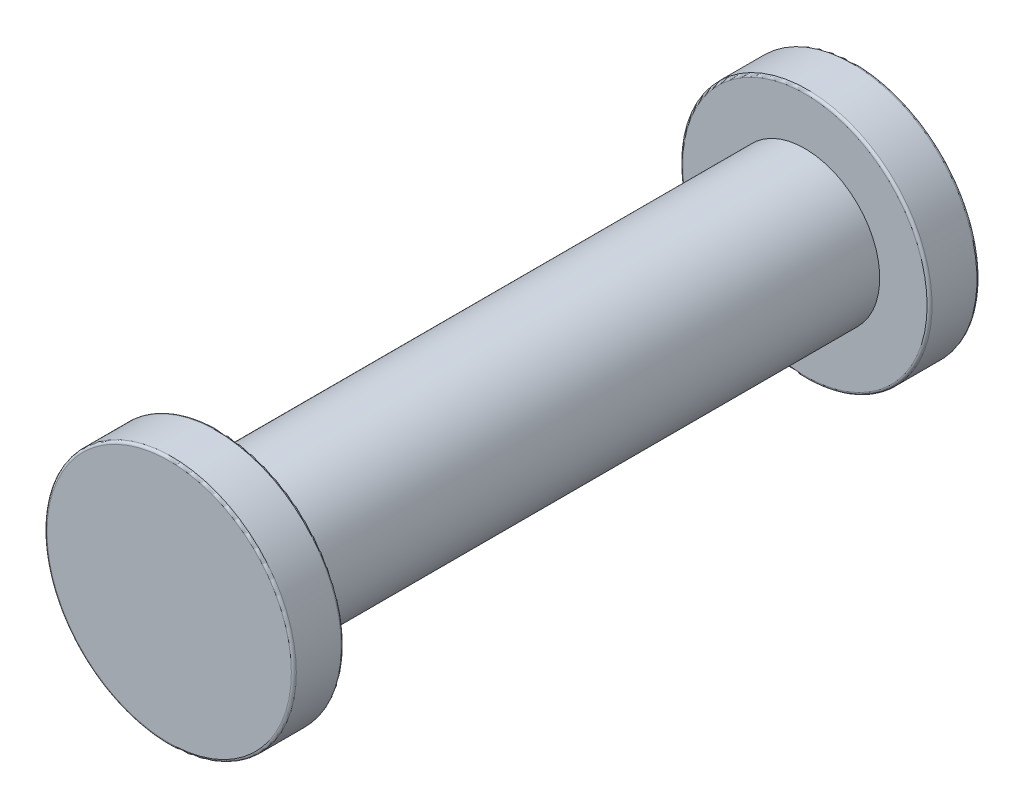
from build123d import *

# Parameters (mm, degrees)
SKETCH1_R           = 2.5
BOSS_EXTRUDE1_DEPTH = 1
SKETCH2_R           = 1.5
BOSS_EXTRUDE2_DEPTH = 11.75
BOSS_EXTRUDE3_START = -12.75
SKETCH1_5_R         = 2.5
BOSS_EXTRUDE3_DEPTH = 1
FILLET1_R           = 0.05
SCALE1_SCALE        = 1.9


with BuildPart() as part:
    # Sketch1 → Boss-Extrude1 (new body)
    with BuildSketch(Plane.XY):
        Circle(SKETCH1_R)
    extrude(amount=-BOSS_EXTRUDE1_DEPTH)

    # Sketch2 → Boss-Extrude2 (add)
    with BuildSketch(Plane(origin=(0, 0, -1), x_dir=(-1, 0, 0), z_dir=(0, 0, -1))):
        Circle(SKETCH2_R)
    extrude(amount=BOSS_EXTRUDE2_DEPTH)

    # Sketch1<5> → Boss-Extrude3 (add)
    with BuildSketch(Plane.XY.offset(BOSS_EXTRUDE3_START)):
        Circle(SKETCH1_5_R)
    extrude(amount=-BOSS_EXTRUDE3_DEPTH)

    # Fillet1
    fillet1_edges = [part.edges().sort_by_distance(p)[0] for p in [
        (-2.5, 0, 0),
        (-2.5, 0, -1),
        (-2.5, 0, -12.75),
        (-2.5, 0, -13.75),
    ]]
    fillet(fillet1_edges, radius=FILLET1_R)


with BuildPart() as part_1:
    # Scale1: scaled about (0, 0, -6.875)
    add(part.part.scale(SCALE1_SCALE).moved(Location((0, 0, 6.1875))))


solid = part_1.part
